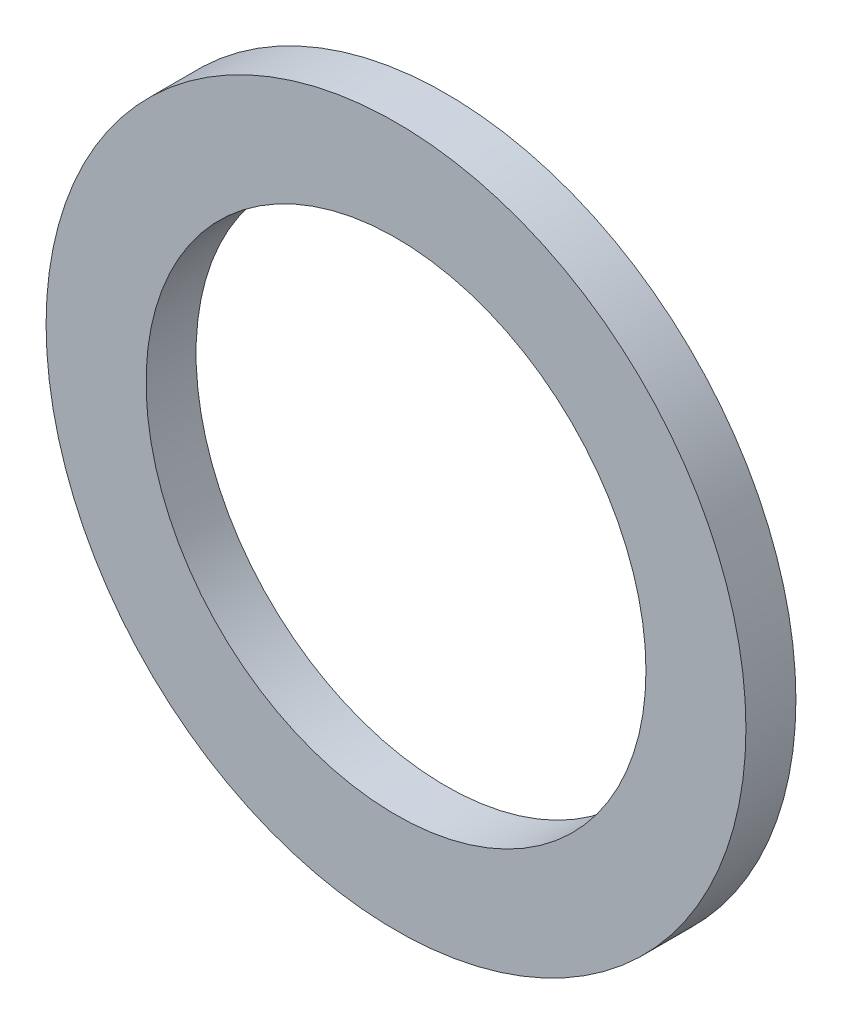
from build123d import *

# Parameters (mm, degrees)
SKETCH_1_R      = 35
SKETCH_1_R_2    = 25
EXTRUDE_1_DEPTH = 5


with BuildPart() as part:
    # 草图1 → 凸台-拉伸1 (new body)
    with BuildSketch(Plane.XY):
        Circle(SKETCH_1_R)
        Circle(SKETCH_1_R_2, mode=Mode.SUBTRACT)
    extrude(amount=EXTRUDE_1_DEPTH)


solid = part.part
